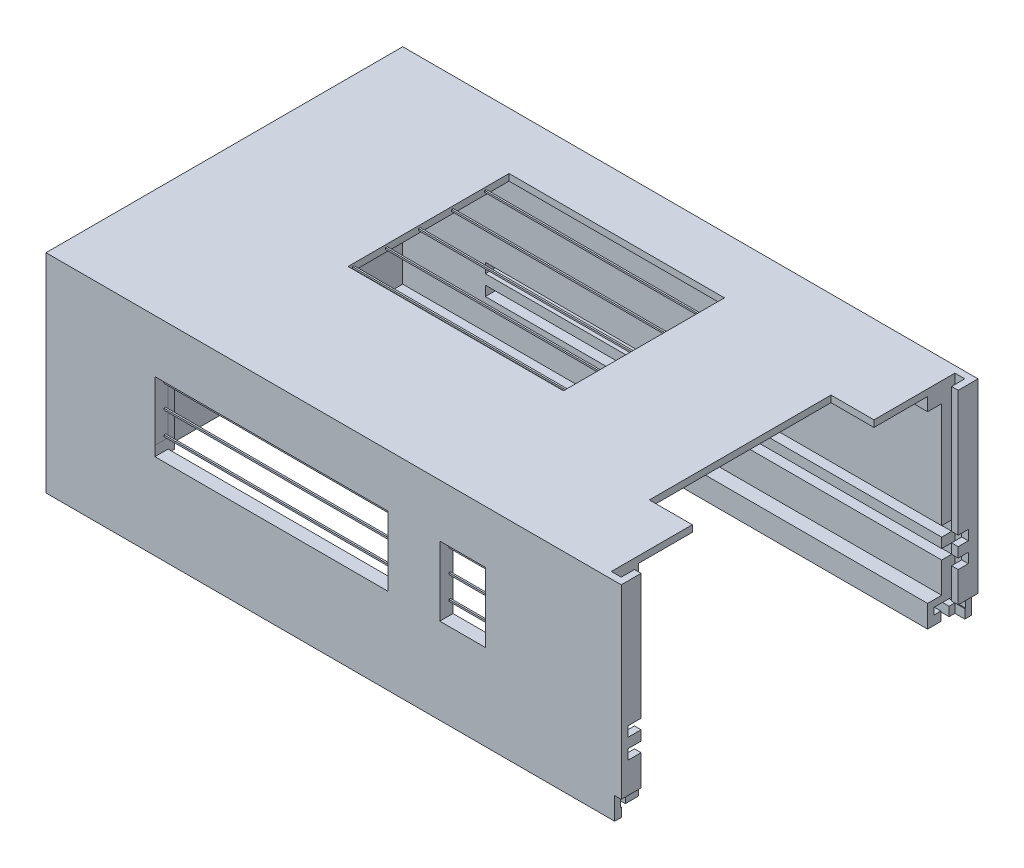
from build123d import *

# Parameters (mm, degrees)
SKETCH_1_W           = 174.15
SKETCH_1_H           = 108
EXTRUDE_1_DEPTH      = 63
CUT_EXTRUDE_2_DEPTH  = 174.15
CUT_EXTRUDE_3_REACH  = 122.279
SKETCH_6_W           = 2
SKETCH_6_H           = 108
SKETCH_7_W           = 96
SKETCH_7_H           = 50.25
CUT_EXTRUDE_5_DEPTH  = 168.15
SKETCH_8_W           = 87.5
SKETCH_8_H           = 4.75
CUT_EXTRUDE_6_DEPTH  = 168.15
SKETCH_10_W          = 168.15
SKETCH_10_H          = 87.5
CUT_EXTRUDE_8_DEPTH  = 59
SKETCH_12_W          = 168.15
SKETCH_12_H          = 96
EXTRUDE_2_DEPTH      = 2
SKETCH_15_W          = 25
SKETCH_15_H          = 70
SKETCH_15_W_2        = 55
SKETCH_15_H_2        = 20
SKETCH_15_W_3        = 44.398131355
SKETCH_15_H_3        = 87.5
CUT_EXTRUDE_9_DEPTH  = 2
SKETCH_16_W          = 25
SKETCH_16_H          = 96
SKETCH_16_W_2        = 32.283516817
CUT_EXTRUDE_10_DEPTH = 2
SKETCH_17_W          = 2
SKETCH_17_H          = 96
EXTRUDE_3_DEPTH      = 5
SKETCH_18_W          = 2
SKETCH_18_H          = 87.5
EXTRUDE_4_DEPTH      = 5
SKETCH_19_W          = 100
SKETCH_19_H          = 18
CUT_EXTRUDE_11_DEPTH = 6
SKETCH_23_W          = 65.205598619
SKETCH_23_H          = 48.744694075
CUT_EXTRUDE_13_DEPTH = 2
CUT_EXTRUDE_START    = -63
CUT_EXTRUDE_14_DEPTH = 63
SKETCH_28_W          = 2
SKETCH_28_H          = 4.25
EXTRUDE_6_DEPTH      = 4.75
SKETCH_31_W          = 13
SKETCH_31_H          = 55
CUT_EXTRUDE_15_DEPTH = 10
SKETCH_34_W          = 103.070926165
SKETCH_34_H          = 3
CUT_EXTRUDE_16_DEPTH = 143.15
SKETCH_37_W          = 96
SKETCH_37_H          = 4
CUT_EXTRUDE_17_DEPTH = 10
SKETCH_38_W          = 123.751868645
SKETCH_38_H          = 87.5
CUT_EXTRUDE_18_DEPTH = 10
CUT_EXTRUDE_20_REACH = 194.907
SKETCH_42_W          = 103.070926165
SKETCH_42_H          = 3
SKETCH_45_W          = 100.033953054
SKETCH_45_H          = 3
CUT_EXTRUDE_21_DEPTH = 6
SKETCH_46_W          = 15.60461182
SKETCH_46_H          = 6
EXTRUDE_7_DEPTH      = 21
SKETCH_47_W          = 100.033953054
SKETCH_47_H          = 22
CUT_EXTRUDE_22_DEPTH = 2
SKETCH_48_W          = 87.5
SKETCH_48_H          = 5
CUT_EXTRUDE_23_DEPTH = 2
SKETCH_49_W          = 108
SKETCH_49_H          = 6.75
CUT_EXTRUDE_24_DEPTH = 2
EXTRUDE_8_DEPTH      = 2
SKETCH_54_W          = 0.5
SKETCH_54_H          = 0.5
EXTRUDE_10_DEPTH     = 65.205598619
EXTRUDE_11_REACH     = 158.761
SKETCH_55_W          = 0.5
SKETCH_55_H          = 0.5


with BuildPart() as part:
    # 스케치1 → 보스-돌출1 (new body)
    with BuildSketch(Plane(origin=(0, 0, 0), x_dir=(1, 0, 0), z_dir=(0, 1, 0))):
        Rectangle(SKETCH_1_W, SKETCH_1_H)
    extrude(amount=EXTRUDE_1_DEPTH)

    # 스케치5 → 컷-돌출2 (cut)
    with BuildSketch(Plane.ZY.offset(87.075)):
        Polygon((-48, 0), (-47.75, 0), (-47.75, 2.75), (-45.75, 2.75), (-45.75, 4.75), (-52.25, 4.75), (-52.25, 2.75), (-50.25, 2.75), (-50.25, 0), (-50, 0), (-50, 3), (-52, 3), (-52, 4.5), (-46, 4.5), (-46, 3), (-48, 3), align=None)
        Polygon((-50, 0), (-48, 0), (-48, 3), (-46, 3), (-46, 4.5), (-52, 4.5), (-52, 3), (-50, 3), align=None)
        Polygon((50, 3), (50, 0), (50.25, 0), (50.25, 2.75), (52.25, 2.75), (52.25, 4.75), (45.75, 4.75), (45.75, 2.75), (47.75, 2.75), (47.75, 0), (48, 0), (48, 3), (46, 3), (46, 4.5), (52, 4.5), (52, 3), align=None)
        Polygon((48, 0), (50, 0), (50, 3), (52, 3), (52, 4.5), (46, 4.5), (46, 3), (48, 3), align=None)
    extrude(amount=-CUT_EXTRUDE_2_DEPTH, mode=Mode.SUBTRACT)

    # 컷-돌출3: up to this face of the body (flat: up to its plane)
    cut_extrude_3_end = Plane(part.part.faces().sort_by_distance((0, 4.75, 49))[0])
    # 스케치6 → 컷-돌출3 (cut, up to the picked face)
    with BuildSketch(Plane.XZ, mode=Mode.PRIVATE) as cut_extrude_3_sk1:
        with Locations((-86.075, 0)):
            Rectangle(SKETCH_6_W, SKETCH_6_H)
    cut_extrude_3_tool1 = split(extrude(cut_extrude_3_sk1.sketch, amount=-CUT_EXTRUDE_3_REACH, mode=Mode.PRIVATE), bisect_by=cut_extrude_3_end, keep=Keep.BOTH, mode=Mode.PRIVATE)
    add(cut_extrude_3_tool1.solids().sort_by(Axis((-86.075, 0, 0), (0, 1, 0)))[0], mode=Mode.SUBTRACT)

    # 스케치7 → 컷-돌출5 (cut)
    with BuildSketch(Plane(origin=(87.075, 0, 0), x_dir=(0, 0, -1), z_dir=(1, 0, 0))):
        with Locations((0, 31.875)):
            Rectangle(SKETCH_7_W, SKETCH_7_H)
    extrude(amount=-CUT_EXTRUDE_5_DEPTH, mode=Mode.SUBTRACT)

    # 스케치8 → 컷-돌출6 (cut)
    with BuildSketch(Plane(origin=(87.075, 0, 0), x_dir=(0, 0, -1), z_dir=(1, 0, 0))):
        with Locations((0, 4.375)):
            Rectangle(SKETCH_8_W, SKETCH_8_H)
    extrude(amount=-CUT_EXTRUDE_6_DEPTH, mode=Mode.SUBTRACT)

    # 스케치10 → 컷-돌출8 (cut)
    with BuildSketch(Plane(origin=(0, 2, 0), x_dir=(1, 0, 0), z_dir=(0, 1, 0))):
        with Locations((3, 0)):
            Rectangle(SKETCH_10_W, SKETCH_10_H)
    extrude(amount=CUT_EXTRUDE_8_DEPTH, mode=Mode.SUBTRACT)

    # 스케치12 → 보스-돌출2 (add)
    with BuildSketch(Plane(origin=(0, 24, 0), x_dir=(-1, 0, 0), z_dir=(0, -1, 0))):
        with Locations((-3, 0)):
            Rectangle(SKETCH_12_W, SKETCH_12_H)
    extrude(amount=EXTRUDE_2_DEPTH)

    # 스케치15 → 컷-돌출9 (cut)
    with BuildSketch(Plane(origin=(0, 2, 0), x_dir=(1, 0, 0), z_dir=(0, 1, 0))):
        with Locations((-68.575, 8.75)):
            Rectangle(SKETCH_15_W, SKETCH_15_H)
        with Locations((-9.233175572, -33.75)):
            Rectangle(SKETCH_15_W_2, SKETCH_15_H_2)
        with Locations((64.875934323, 0)):
            Rectangle(SKETCH_15_W_3, SKETCH_15_H_3)
    extrude(amount=-CUT_EXTRUDE_9_DEPTH, mode=Mode.SUBTRACT)

    # 스케치16 → 컷-돌출10 (cut)
    with BuildSketch(Plane(origin=(0, 24, 0), x_dir=(1, 0, 0), z_dir=(0, 1, 0))):
        with Locations((-68.575, 0)):
            Rectangle(SKETCH_16_W, SKETCH_16_H)
        with Locations((70.933241592, 0)):
            Rectangle(SKETCH_16_W_2, SKETCH_16_H)
    extrude(amount=-CUT_EXTRUDE_10_DEPTH, mode=Mode.SUBTRACT)

    # 스케치17 → 보스-돌출3 (add)
    with BuildSketch(Plane(origin=(0, 24, 0), x_dir=(1, 0, 0), z_dir=(0, 1, 0))):
        with Locations((-55.075, 0)):
            Rectangle(SKETCH_17_W, SKETCH_17_H)
    extrude(amount=EXTRUDE_3_DEPTH)

    # 스케치18 → 보스-돌출4 (add)
    with BuildSketch(Plane(origin=(0, 2, 0), x_dir=(1, 0, 0), z_dir=(0, 1, 0))):
        with Locations((-55.075, 0)):
            Rectangle(SKETCH_18_W, SKETCH_18_H)
    extrude(amount=EXTRUDE_4_DEPTH)

    # 스케치19 → 컷-돌출11 (cut)
    with BuildSketch(Plane(origin=(0, 0, 48), x_dir=(-1, 0, 0), z_dir=(0, 0, -1))):
        with Locations((4.075, 38)):
            Rectangle(SKETCH_19_W, SKETCH_19_H)
    extrude(amount=-CUT_EXTRUDE_11_DEPTH, mode=Mode.SUBTRACT)

    # 스케치23 → 컷-돌출13 (cut)
    with BuildSketch(Plane(origin=(0, 63, 0), x_dir=(1, 0, 0), z_dir=(0, 1, 0))):
        with Locations((-5.140341164, 12.481591832)):
            Rectangle(SKETCH_23_W, SKETCH_23_H)
    extrude(amount=-CUT_EXTRUDE_13_DEPTH, mode=Mode.SUBTRACT)

    # 스케치26 → 컷-돌출14 (cut)
    with BuildSketch(Plane(origin=(0, 63, 0), x_dir=(1, 0, 0), z_dir=(0, 1, 0)).offset(CUT_EXTRUDE_START)):
        Polygon((82.075, 52), (85.075, 52), (85.075, 48), (87.075, 48), (87.075, -48), (85.075, -48), (85.075, -52), (82.075, -52), align=None)
    extrude(amount=CUT_EXTRUDE_14_DEPTH, mode=Mode.SUBTRACT)

    # 스케치28 → 보스-돌출6 (add)
    with BuildSketch(Plane.XZ.offset(-4.75)):
        with Locations((86.075, 50.125)):
            Rectangle(SKETCH_28_W, SKETCH_28_H)
        with Locations((86.075, -50.125)):
            Rectangle(SKETCH_28_W, SKETCH_28_H)
    extrude(amount=EXTRUDE_6_DEPTH)

    # 스케치31 → 컷-돌출15 (cut)
    with BuildSketch(Plane(origin=(0, 63, 0), x_dir=(1, 0, 0), z_dir=(0, 1, 0))):
        with Locations((75.575, 0)):
            Rectangle(SKETCH_31_W, SKETCH_31_H)
    extrude(amount=-CUT_EXTRUDE_15_DEPTH, mode=Mode.SUBTRACT)

    # 스케치34 → 컷-돌출16 (cut)
    with BuildSketch(Plane(origin=(87.075, 0, 0), x_dir=(0, 0, -1), z_dir=(1, 0, 0))):
        with Locations((-0.464536917, 23.5)):
            Rectangle(SKETCH_34_W, SKETCH_34_H)
    extrude(amount=-CUT_EXTRUDE_16_DEPTH, mode=Mode.SUBTRACT)

    # 스케치37 → 컷-돌출17 (cut)
    with BuildSketch(Plane(origin=(-54.075, 0, 0), x_dir=(0, 0, -1), z_dir=(1, 0, 0))):
        with Locations((0, 27)):
            Rectangle(SKETCH_37_W, SKETCH_37_H)
    extrude(amount=-CUT_EXTRUDE_17_DEPTH, mode=Mode.SUBTRACT)

    # 스케치38 → 컷-돌출18 (cut)
    with BuildSketch(Plane(origin=(0, 2, 0), x_dir=(1, 0, 0), z_dir=(0, 1, 0))):
        with Locations((-19.199065677, 0)):
            Rectangle(SKETCH_38_W, SKETCH_38_H)
    extrude(amount=-CUT_EXTRUDE_18_DEPTH, mode=Mode.SUBTRACT)

    # 컷-돌출20: up to this face of the body (flat: up to its plane)
    cut_extrude_20_end = Plane(part.part.faces().sort_by_distance((-56.075, 23.5, -49.535463082))[0])
    # 스케치42 → 컷-돌출20 (cut, up to the picked face)
    with BuildSketch(Plane(origin=(87.075, 0, 0), x_dir=(0, 0, -1), z_dir=(1, 0, 0)), mode=Mode.PRIVATE) as cut_extrude_20_sk1:
        with Locations((-0.464536917, 17.5)):
            Rectangle(SKETCH_42_W, SKETCH_42_H)
    cut_extrude_20_tool1 = split(extrude(cut_extrude_20_sk1.sketch, amount=-CUT_EXTRUDE_20_REACH, mode=Mode.PRIVATE), bisect_by=cut_extrude_20_end, keep=Keep.BOTH, mode=Mode.PRIVATE)
    add(cut_extrude_20_tool1.solids().sort_by(Axis((87.075, 17.5, 0.464537), (-1, 0, 0)))[0], mode=Mode.SUBTRACT)

    # 스케치45 → 컷-돌출21 (cut)
    with BuildSketch(Plane(origin=(0, 0, 48), x_dir=(-1, 0, 0), z_dir=(0, 0, -1))):
        with Locations((4.091976527, 27.5)):
            Rectangle(SKETCH_45_W, SKETCH_45_H)
    extrude(amount=-CUT_EXTRUDE_21_DEPTH, mode=Mode.SUBTRACT)

    # 스케치46 → 보스-돌출7 (add)
    with BuildSketch(Plane(origin=(0, 26, 0), x_dir=(1, 0, 0), z_dir=(0, 1, 0))):
        with Locations((24.337049492, -51)):
            Rectangle(SKETCH_46_W, SKETCH_46_H)
    extrude(amount=EXTRUDE_7_DEPTH)

    # 스케치47 → 컷-돌출22 (cut)
    with BuildSketch(Plane(origin=(0, 0, 48), x_dir=(-1, 0, 0), z_dir=(0, 0, -1))):
        with Locations((4.091976527, 36)):
            Rectangle(SKETCH_47_W, SKETCH_47_H)
    extrude(amount=-CUT_EXTRUDE_22_DEPTH, mode=Mode.SUBTRACT)

    # 스케치48 → 컷-돌출23 (cut)
    with BuildSketch(Plane(origin=(-54.075, 0, 0), x_dir=(0, 0, -1), z_dir=(1, 0, 0))):
        with Locations((0, 4.5)):
            Rectangle(SKETCH_48_W, SKETCH_48_H)
    extrude(amount=-CUT_EXTRUDE_23_DEPTH, mode=Mode.SUBTRACT)

    # 스케치49 → 컷-돌출24 (cut)
    with BuildSketch(Plane(origin=(87.075, 0, 0), x_dir=(0, 0, -1), z_dir=(1, 0, 0))):
        with Locations((0, 3.375)):
            Rectangle(SKETCH_49_W, SKETCH_49_H)
    extrude(amount=-CUT_EXTRUDE_24_DEPTH, mode=Mode.SUBTRACT)

    # 스케치51 → 보스-돌출8 (add)
    with BuildSketch(Plane.ZY.offset(85.075)):
        Polygon((52.25, 2.75), (50.25, 2.75), (50.25, 0), (54, 0), (54, 4.75), (52.25, 4.75), align=None)
        Polygon((-52.25, 2.75), (-52.25, 4.75), (-54, 4.75), (-54, 0), (-50.25, 0), (-50.25, 2.75), align=None)
        Polygon((47.75, 2.75), (45.75, 2.75), (45.75, 4.75), (-45.75, 4.75), (-45.75, 2.75), (-47.75, 2.75), (-47.75, 0), (47.75, 0), align=None)
    extrude(amount=EXTRUDE_8_DEPTH)

    # 스케치54 → 보스-돌출10 (add)
    with BuildSketch(Plane(origin=(-37.743140474, 0, 0), x_dir=(0, 0, -1), z_dir=(1, 0, 0))):
        with Locations((-10.286427881, 62)):
            Rectangle(SKETCH_54_W, SKETCH_54_H)
        with Locations((-0.286427881, 62)):
            Rectangle(SKETCH_54_W, SKETCH_54_H)
        with Locations((9.713572119, 62)):
            Rectangle(SKETCH_54_W, SKETCH_54_H)
        with Locations((19.713572119, 62)):
            Rectangle(SKETCH_54_W, SKETCH_54_H)
        with Locations((29.713572119, 62)):
            Rectangle(SKETCH_54_W, SKETCH_54_H)
    extrude(amount=EXTRUDE_10_DEPTH)

    # 보스-돌출11: up to this face of the body (flat: up to its plane)
    extrude_11_end = Plane(part.part.faces().sort_by_distance((-87.075, 31.667900174, 0))[0])
    # 스케치55 → 보스-돌출11 (add, up to the picked face)
    with BuildSketch(Plane.ZY.offset(-45.925), mode=Mode.PRIVATE) as extrude_11_sk1:
        with Locations((51, 44.102500149)):
            Rectangle(SKETCH_55_W, SKETCH_55_H)
    extrude_11_tool1 = split(extrude(extrude_11_sk1.sketch, amount=EXTRUDE_11_REACH, mode=Mode.PRIVATE), bisect_by=extrude_11_end, keep=Keep.BOTH, mode=Mode.PRIVATE)
    # 스케치55 → 보스-돌출11 (add, up to the picked face)
    with BuildSketch(Plane.ZY.offset(-45.925), mode=Mode.PRIVATE) as extrude_11_sk2:
        with Locations((51, 37.102500149)):
            Rectangle(SKETCH_55_W, SKETCH_55_H)
    extrude_11_tool2 = split(extrude(extrude_11_sk2.sketch, amount=EXTRUDE_11_REACH, mode=Mode.PRIVATE), bisect_by=extrude_11_end, keep=Keep.BOTH, mode=Mode.PRIVATE)
    # 스케치55 → 보스-돌출11 (add, up to the picked face)
    with BuildSketch(Plane.ZY.offset(-45.925), mode=Mode.PRIVATE) as extrude_11_sk3:
        with Locations((51, 30.102500149)):
            Rectangle(SKETCH_55_W, SKETCH_55_H)
    extrude_11_tool3 = split(extrude(extrude_11_sk3.sketch, amount=EXTRUDE_11_REACH, mode=Mode.PRIVATE), bisect_by=extrude_11_end, keep=Keep.BOTH, mode=Mode.PRIVATE)
    add(extrude_11_tool1.solids().sort_by(Axis((45.925, 44.1025, 51), (-1, 0, 0)))[0])
    add(extrude_11_tool2.solids().sort_by(Axis((45.925, 37.1025, 51), (-1, 0, 0)))[0])
    add(extrude_11_tool3.solids().sort_by(Axis((45.925, 30.1025, 51), (-1, 0, 0)))[0])


solid = part.part
